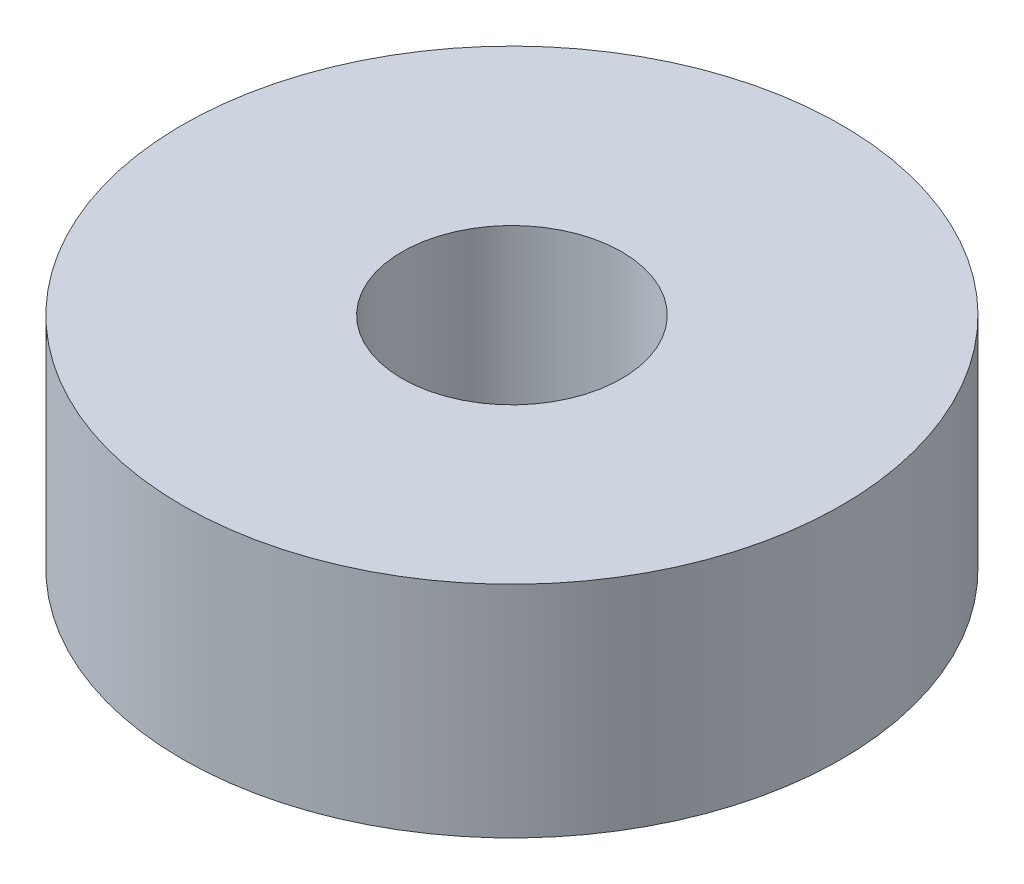
from build123d import *

# Parameters (mm, degrees)
SKETCH1_R           = 15
SKETCH1_R_2         = 5
BOSS_EXTRUDE1_DEPTH = 10


with BuildPart() as part:
    # Sketch1 → Boss-Extrude1 (new body)
    with BuildSketch(Plane(origin=(0, 0, 0), x_dir=(1, 0, 0), z_dir=(0, 1, 0))):
        with Locations(Location((0, 0, 0), (0, 0, 270))):
            Circle(SKETCH1_R)
        with Locations(Location((0, 0, 0), (0, 0, 270))):
            Circle(SKETCH1_R_2, mode=Mode.SUBTRACT)
    extrude(amount=BOSS_EXTRUDE1_DEPTH)


solid = part.part
